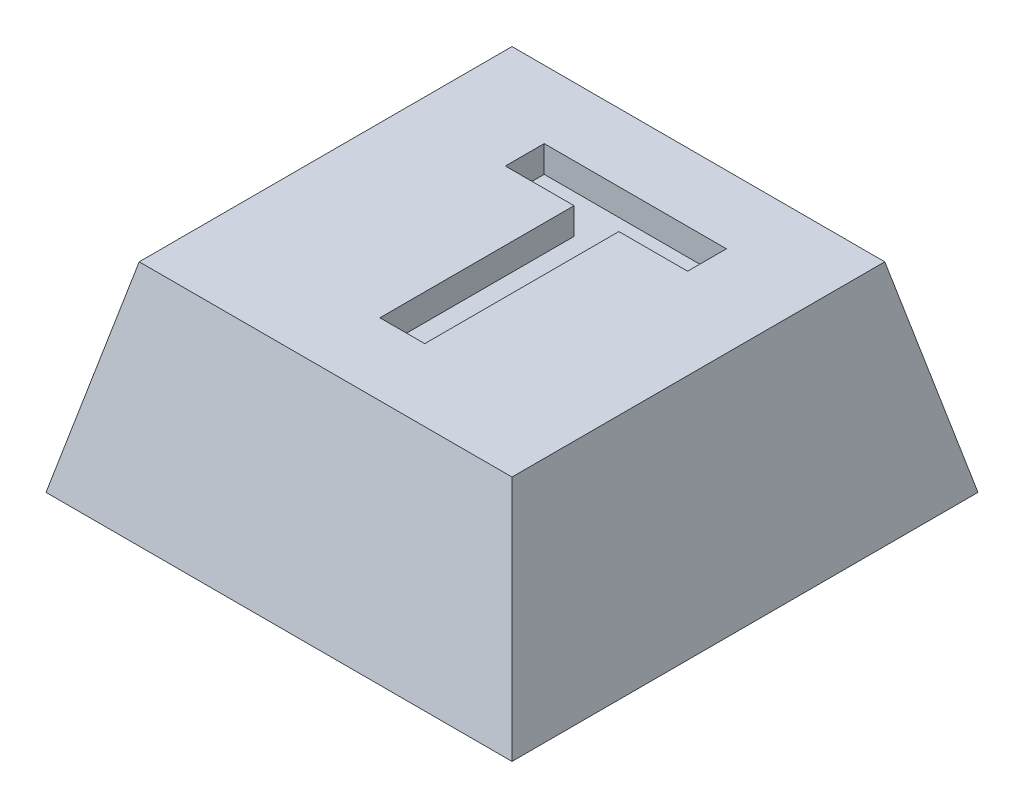
from build123d import *

# Parameters (mm, degrees)
SKETCH1_W           = 7
SKETCH1_H           = 7
BOSS_EXTRUDE1_DEPTH = 3
CUT_EXTRUDE1_DEPTH  = 7
CUT_EXTRUDE2_DEPTH  = 11
SKETCH4_R           = 1.8
CUT_EXTRUDE3_DEPTH  = 0.8
CUT_EXTRUDE4_DEPTH  = 0.4


with BuildPart() as part:
    # Sketch1 → Boss-Extrude1 (new body)
    with BuildSketch(Plane(origin=(0, 0, 0), x_dir=(1, 0, 0), z_dir=(0, 1, 0))):
        with Locations((3.5, 3.5)):
            Rectangle(SKETCH1_W, SKETCH1_H)
    extrude(amount=BOSS_EXTRUDE1_DEPTH)

    # Sketch2 → Cut-Extrude1 (cut)
    with BuildSketch(Plane.XY):
        Polygon((0, 0), (0.7, 3), (0, 3), align=None)
        Polygon((7, 0), (6.3, 3), (7, 3), align=None)
    extrude(amount=-CUT_EXTRUDE1_DEPTH, mode=Mode.SUBTRACT)

    # Sketch3 → Cut-Extrude2 (cut)
    with BuildSketch(Plane(origin=(0, 0, 0), x_dir=(0, 0, -1), z_dir=(1, 0, 0))):
        Polygon((0, 0), (0.7, 3), (0, 3), align=None)
        Polygon((7, 3), (6.3, 3), (7, 0), align=None)
    extrude(amount=CUT_EXTRUDE2_DEPTH, mode=Mode.SUBTRACT)

    # Sketch4 → Cut-Extrude3 (cut)
    with BuildSketch(Plane.XZ):
        with Locations(Location((3.5, -3.5, 0), (0, 0, 270))):
            Circle(SKETCH4_R)
    extrude(amount=-CUT_EXTRUDE3_DEPTH, mode=Mode.SUBTRACT)

    # Sketch5 → Cut-Extrude4 (cut)
    with BuildSketch(Plane(origin=(0, 3, 0), x_dir=(1, 0, 0), z_dir=(0, 1, 0))):
        Polygon((3.236309529, 1.779523254), (3.236309529, 4.696189921), (2.204258247, 4.696189921), (2.204258247, 5.279523254), (4.941437734, 5.279523254), (4.941437734, 4.696189921), (3.909386452, 4.696189921), (3.909386452, 1.779523254), align=None)
    extrude(amount=-CUT_EXTRUDE4_DEPTH, mode=Mode.SUBTRACT)


solid = part.part
